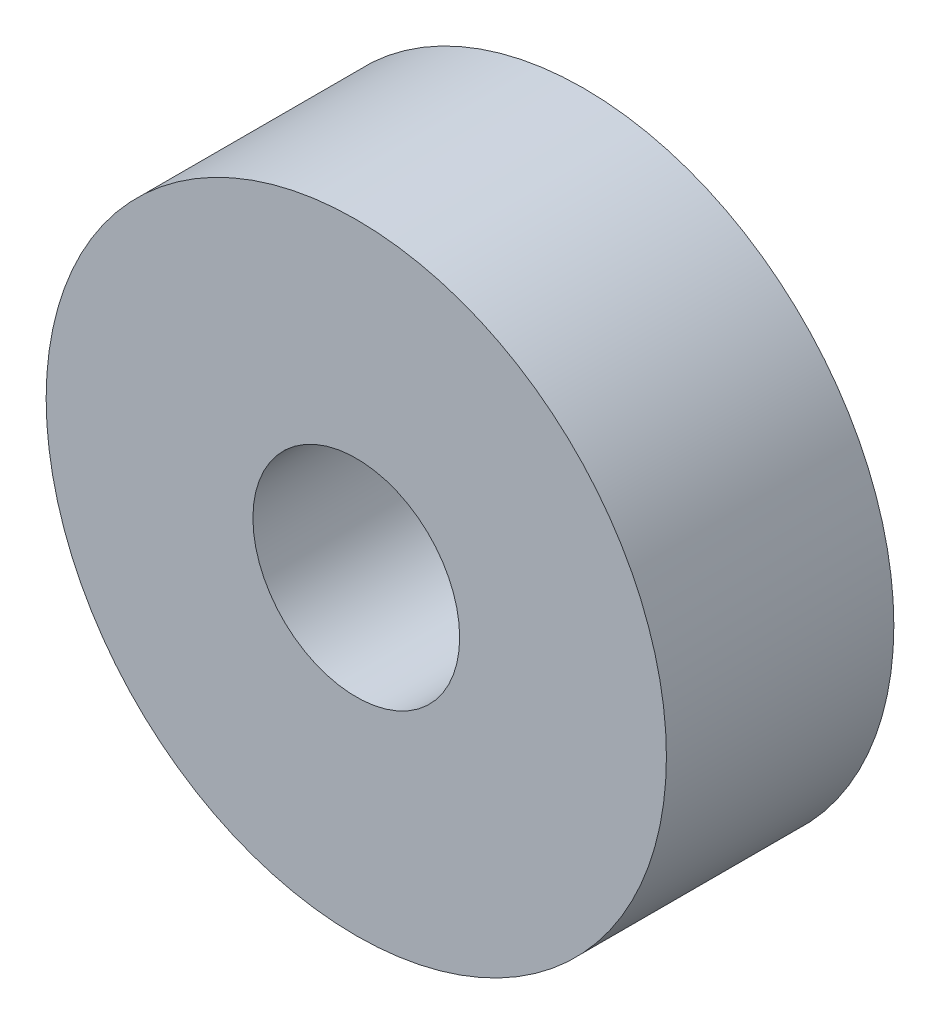
from build123d import *

# Parameters (mm, degrees)
SKETCH1_R           = 3
SKETCH1_R_2         = 1
BOSS_EXTRUDE1_DEPTH = 2.2


with BuildPart() as part:
    # Sketch1 → Boss-Extrude1 (new body)
    with BuildSketch(Plane.XY):
        Circle(SKETCH1_R)
        Circle(SKETCH1_R_2, mode=Mode.SUBTRACT)
    extrude(amount=BOSS_EXTRUDE1_DEPTH)


solid = part.part
